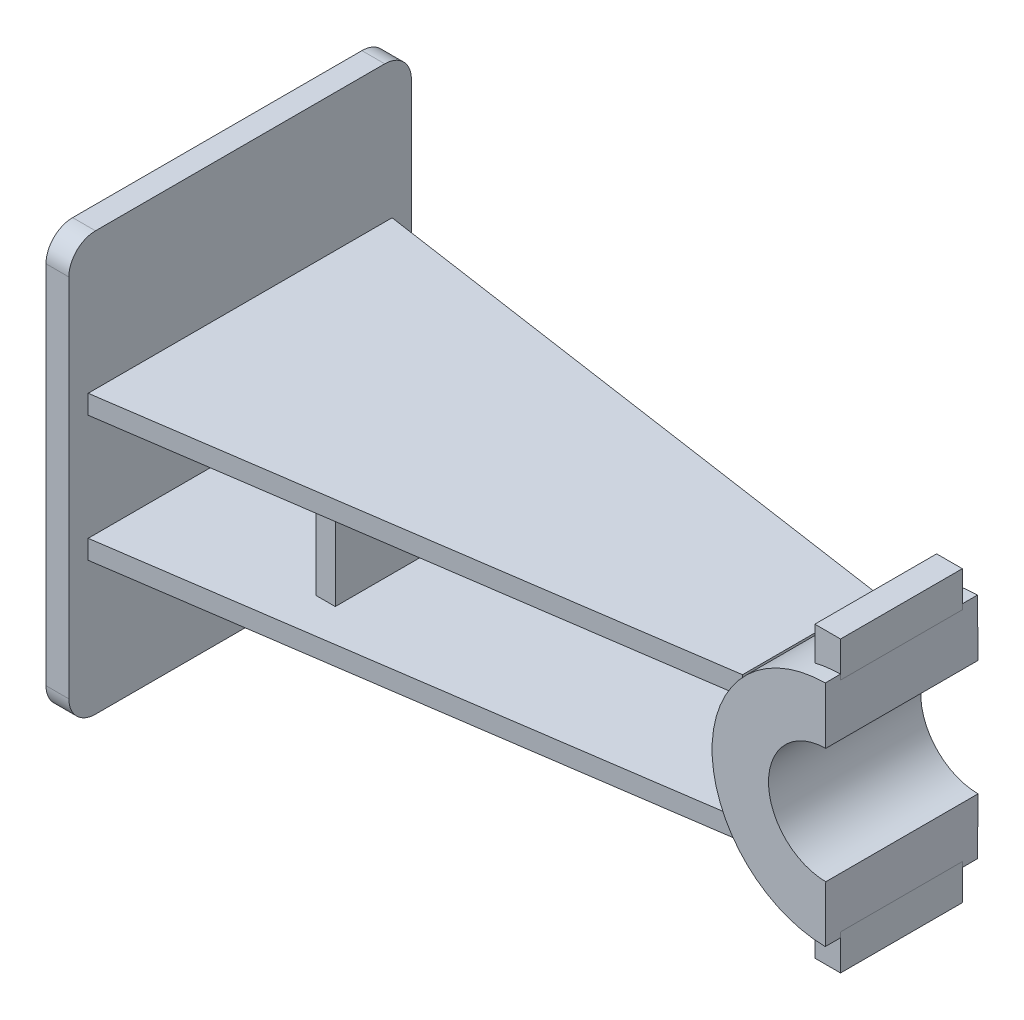
from build123d import *

# Parameters (mm, degrees)
EXTRUDE_START         = -360
EXTRUDE_1_DEPTH       = 12
EXTRUDE_START_2       = 28
EXTRUDE_2_DEPTH       = 10
EXTRUDE_START_3       = -38
EXTRUDE_3_DEPTH       = 10
EXTRUDE_START_4       = -46
EXTRUDE_SKETCH_4_W    = 10
EXTRUDE_SKETCH_4_H    = 56
EXTRUDE_4_DEPTH       = 92
REVOLVE_PROFILE_1_W   = 29.65
REVOLVE_PROFILE_1_H   = 80
REVOLVE_1_ANGLE       = 179
REVOLVE_INDEX_1_ANGLE = 90.5
EXTRUDE_START_5       = -32
EXTRUDE_SKETCH_5_W    = 13.5
EXTRUDE_SKETCH_5_H    = 20
EXTRUDE_5_DEPTH       = 64
EXTRUDE_SKETCH_6_W    = 13.5
EXTRUDE_SKETCH_6_H    = 20
EXTRUDE_6_DEPTH       = 64


with BuildPart() as part:
    # Extrude sketch 1 → Extrude 1 (new body)
    with BuildSketch(Plane(origin=(0, 0, 0), x_dir=(0, 0, -1), z_dir=(1, 0, 0)).offset(EXTRUDE_START)):
        with BuildLine():
            Line((-90, 96), (-90, -96))
            ThreePointArc((-90, -96), (-85.899494937, -105.899494937), (-76, -110))
            Line((-76, -110), (76, -110))
            ThreePointArc((76, -110), (85.899494937, -105.899494937), (90, -96))
            Line((90, -96), (90, 96))
            ThreePointArc((90, 96), (85.899494937, 105.899494937), (76, 110))
            Line((76, 110), (-76, 110))
            ThreePointArc((-76, 110), (-85.899494937, 105.899494937), (-90, 96))
        make_face()
    extrude(amount=EXTRUDE_1_DEPTH)


with BuildPart() as body_2:
    # Extrude sketch 2 → Extrude 2 (new body)
    with BuildSketch(Plane(origin=(0, 0, 0), x_dir=(1, 0, 0), z_dir=(0, 1, 0)).offset(EXTRUDE_START_2)):
        Polygon((-349, 80), (-48, 36), (-48, -36), (-349, -80), align=None)
    extrude(amount=EXTRUDE_2_DEPTH)


with BuildPart() as body_3:
    # Extrude sketch 3 → Extrude 3 (new body)
    with BuildSketch(Plane(origin=(0, 0, 0), x_dir=(1, 0, 0), z_dir=(0, 1, 0)).offset(EXTRUDE_START_3)):
        Polygon((-349, 80), (-48, 36), (-48, -36), (-349, -80), align=None)
    extrude(amount=EXTRUDE_3_DEPTH)


with BuildPart() as body_4:
    # Extrude sketch 4 → Extrude 4 (new body)
    with BuildSketch(Plane.XY.offset(EXTRUDE_START_4)):
        with Locations((-257, 0)):
            Rectangle(EXTRUDE_SKETCH_4_W, EXTRUDE_SKETCH_4_H)
    extrude(amount=EXTRUDE_4_DEPTH)


with BuildPart() as body_5:
    # Revolve profile 1 → Revolve 1 (revolve)
    with BuildSketch(Plane(origin=(0, 0, 0), x_dir=(1, 0, 0), z_dir=(0, 1, 0))):
        with Locations((45.175, 0)):
            Rectangle(REVOLVE_PROFILE_1_W, REVOLVE_PROFILE_1_H)
    revolve(axis=Axis((0, 0, -45), (0, 0, 1)), revolution_arc=REVOLVE_1_ANGLE)


with BuildPart() as body_5_1:
    # Revolve index 1: moved
    add(body_5.part.rotate(Axis((0, 0, 0), (0, 0, 1)), REVOLVE_INDEX_1_ANGLE))


with BuildPart() as body_6:
    # Extrude sketch 5 → Extrude 5 (new body)
    with BuildSketch(Plane.XY.offset(EXTRUDE_START_5)):
        with Locations((-7.25, 66)):
            Rectangle(EXTRUDE_SKETCH_5_W, EXTRUDE_SKETCH_5_H)
    extrude(amount=EXTRUDE_5_DEPTH)


with BuildPart() as body_7:
    # Extrude sketch 6 → Extrude 6 (new body)
    with BuildSketch(Plane.XY.offset(EXTRUDE_START_5)):
        with Locations((-7.25, -66)):
            Rectangle(EXTRUDE_SKETCH_6_W, EXTRUDE_SKETCH_6_H)
    extrude(amount=EXTRUDE_6_DEPTH)

    # Combine (weld / assembly of features): union body 2, body 5, body 3, body 4, body 6, part
    add(body_2.part)
    add(body_5_1.part)
    add(body_3.part)
    add(body_4.part)
    add(body_6.part)
    add(part.part)


solid = body_7.part
